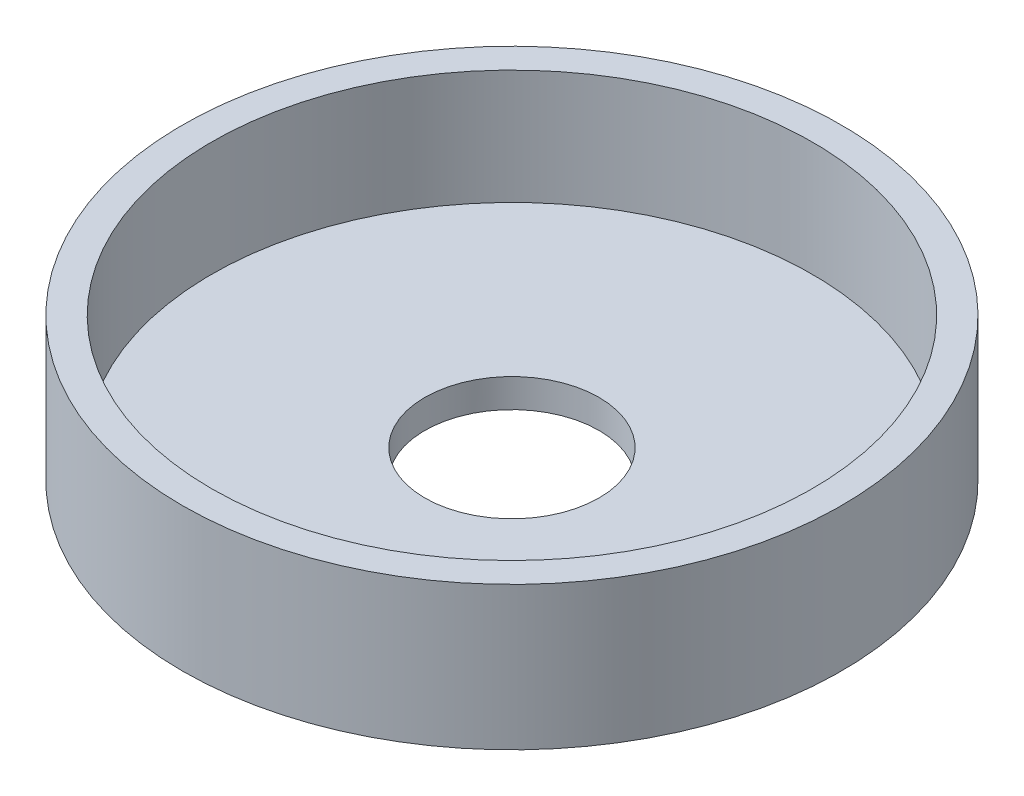
from build123d import *

# Parameters (mm, degrees)
SKETCH1_R           = 73.025
BOSS_EXTRUDE1_DEPTH = 6.35
SKETCH2_R           = 73.025
SKETCH2_R_2         = 66.548
BOSS_EXTRUDE2_DEPTH = 25.4
CUT_EXTRUDE1_REACH  = 110.043
SKETCH3_R           = 19.304


with BuildPart() as part:
    # Sketch1 → Boss-Extrude1 (new body)
    with BuildSketch(Plane(origin=(0, 0, 0), x_dir=(1, 0, 0), z_dir=(0, 1, 0))):
        with Locations(Location((0, 0, 0), (0, 0, 270))):
            Circle(SKETCH1_R)
    extrude(amount=BOSS_EXTRUDE1_DEPTH)

    # Sketch2 → Boss-Extrude2 (add)
    with BuildSketch(Plane(origin=(0, 6.35, 0), x_dir=(1, 0, 0), z_dir=(0, 1, 0))):
        with Locations(Location((0, 0, 0), (0, 0, 270))):
            Circle(SKETCH2_R)
        with Locations(Location((0, 0, 0), (0, 0, 270))):
            Circle(SKETCH2_R_2, mode=Mode.SUBTRACT)
    extrude(amount=BOSS_EXTRUDE2_DEPTH)

    # Sketch3 → Cut-Extrude1 (cut, up to next)
    with BuildSketch(Plane.XZ, mode=Mode.PRIVATE) as cut_extrude1_sk1:
        with Locations(Location((0, 0, 0), (0, 0, 270))):
            Circle(SKETCH3_R)
    cut_extrude1_tool1 = extrude(cut_extrude1_sk1.sketch, amount=-CUT_EXTRUDE1_REACH, mode=Mode.PRIVATE) & part.part
    add(cut_extrude1_tool1.solids().sort_by_distance((0, 0, 0))[0], mode=Mode.SUBTRACT)


solid = part.part
